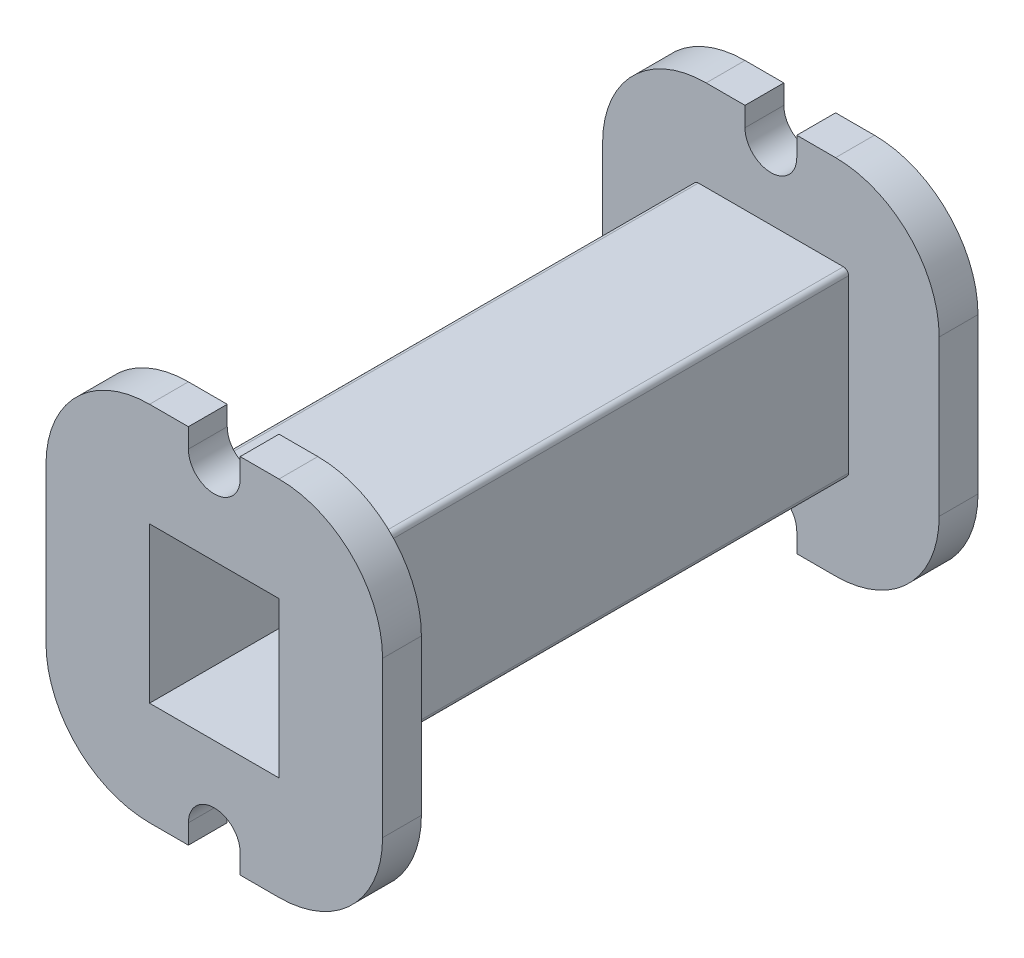
from build123d import *

# Parameters (mm, degrees)
SKETCH_1_W               = 6
SKETCH_1_H               = 7
SKETCH_1_W_2             = 5
SKETCH_1_H_2             = 6
EXTRUDE_1_DEPTH          = 11.5
SKETCH_2_W               = 6
SKETCH_2_H               = 7
EXTRUDE_2_DEPTH          = 1.5
SKETCH_3_R               = 19.100398606
SKETCH_3_W               = 18.715870292
SKETCH_3_H               = 14
CUT_EXTRUDE_1_DEPTH      = 26.719642299
CUT_EXTRUDE_2_DEPTH      = 25.904818811
CUT_EXTRUDE_3_DEPTH      = 25.904818811
CUT_EXTRUDE_3_DEPTH_BACK = 25.904818811
FILLET_1_R               = 0.2


with BuildPart() as part:
    # 草图1 → 凸台-拉伸1 (new, symmetric)
    with BuildSketch(Plane.XY):
        Rectangle(SKETCH_1_W, SKETCH_1_H)
        Rectangle(SKETCH_1_W_2, SKETCH_1_H_2, mode=Mode.SUBTRACT)
    extrude(amount=EXTRUDE_1_DEPTH, both=True)

    # 草图2 → 凸台-拉伸2 (add)
    with BuildSketch(Plane.XY.offset(11.5)):
        with BuildLine():
            Line((-6.5, 6.92820323), (-6.5, -6.92820323))
            ThreePointArc((-6.5, -6.92820323), (0, -9.5), (6.5, -6.92820323))
            Line((6.5, -6.92820323), (6.5, 6.92820323))
            ThreePointArc((6.5, 6.92820323), (0, 9.5), (-6.5, 6.92820323))
        make_face()
        Rectangle(SKETCH_2_W, SKETCH_2_H, mode=Mode.SUBTRACT)
    extrude_2 = extrude(amount=-EXTRUDE_2_DEPTH)

    # 镜向1: 凸台-拉伸2 across plane
    add(extrude_2.mirror(Plane.XY))

    # 草图3 → 切除-拉伸1 (cut, through all)
    with BuildSketch(Plane.XY.offset(11.5)):
        Circle(SKETCH_3_R)
        Rectangle(SKETCH_3_W, SKETCH_3_H, mode=Mode.SUBTRACT)
    extrude(amount=-CUT_EXTRUDE_1_DEPTH, mode=Mode.SUBTRACT)

    # 草图4 → 切除-拉伸2 (cut, through all)
    with BuildSketch(Plane.XY.offset(11.5)):
        with BuildLine():
            Line((-6.5, 6.92820323), (-6.5, 3))
            ThreePointArc((-6.5, 3), (-5.328427125, 5.828427125), (-2.5, 7))
            Line((-2.5, 7), (-6.422616289, 7))
            ThreePointArc((-6.422616289, 7), (-6.461407868, 6.964209098), (-6.5, 6.92820323))
        make_face()
        with BuildLine():
            ThreePointArc((2.5, 7), (5.328427125, 5.828427125), (6.5, 3))
            Line((6.5, 3), (6.5, 6.92820323))
            ThreePointArc((6.5, 6.92820323), (6.461407868, 6.964209098), (6.422616289, 7))
            Line((6.422616289, 7), (2.5, 7))
        make_face()
        with BuildLine():
            ThreePointArc((6.5, -3), (5.328427127, -5.828427123), (2.500000005, -7))
            Line((2.500000005, -7), (6.422616289, -7))
            ThreePointArc((6.422616289, -7), (6.461407868, -6.964209098), (6.5, -6.92820323))
            Line((6.5, -6.92820323), (6.5, -3))
        make_face()
        with BuildLine():
            ThreePointArc((-6.5, -6.92820323), (-6.461407868, -6.964209098), (-6.422616289, -7))
            Line((-6.422616289, -7), (-2.499999995, -7))
            ThreePointArc((-2.499999995, -7), (-5.328427123, -5.828427127), (-6.5, -3))
            Line((-6.5, -3), (-6.5, -6.92820323))
        make_face()
    extrude(amount=-CUT_EXTRUDE_2_DEPTH, mode=Mode.SUBTRACT)

    # 草图5 → 切除-拉伸3 (cut, two sides: drawn at the far end of the back side and taken through both)
    with BuildSketch(Plane.XY.offset(11.5).offset(-CUT_EXTRUDE_3_DEPTH_BACK)):
        with BuildLine():
            Line((1, 6.25), (1, 7))
            Line((1, 7), (-1, 7))
            Line((-1, 7), (-1, 6.25))
            ThreePointArc((-1, 6.25), (0, 5.25), (1, 6.25))
        make_face()
        with BuildLine():
            Line((1, -7), (1, -6.25))
            ThreePointArc((1, -6.25), (0, -5.25), (-1, -6.25))
            Line((-1, -6.25), (-1, -7))
            Line((-1, -7), (1, -7))
        make_face()
    extrude(amount=CUT_EXTRUDE_3_DEPTH + CUT_EXTRUDE_3_DEPTH_BACK, mode=Mode.SUBTRACT)

    # 圆角1
    fillet_1_edges = [part.edges().sort_by_distance(p)[0] for p in [
        (-3, 3.5, 0),
        (3, 3.5, 0),
        (3, -3.5, 0),
        (-3, -3.5, 0),
    ]]
    fillet(fillet_1_edges, radius=FILLET_1_R)


solid = part.part
